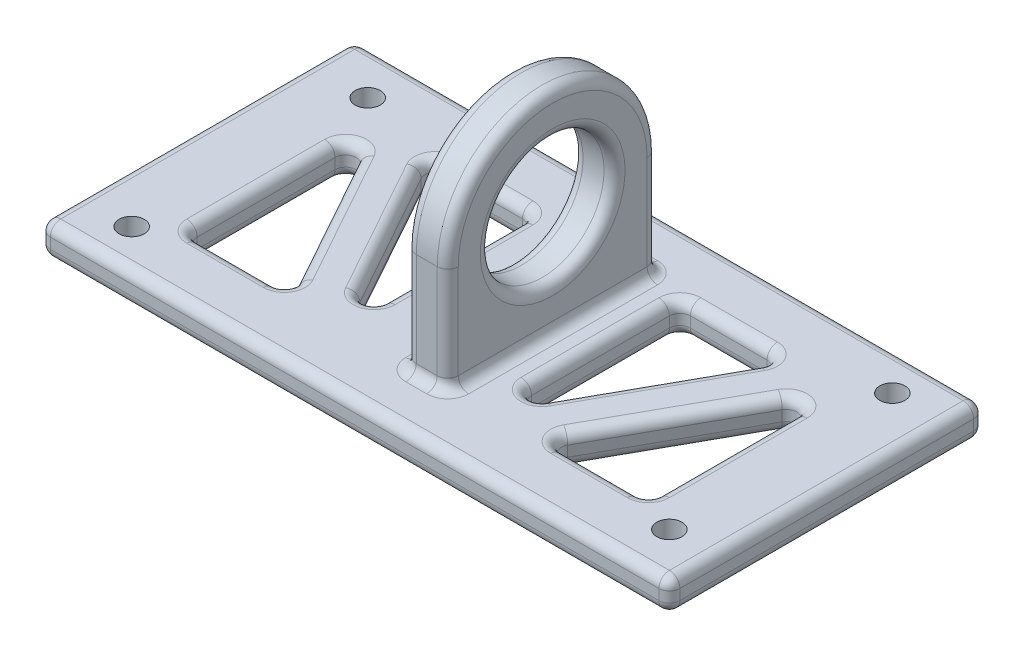
from build123d import *

# Parameters (mm, degrees)
SKETCH1_W               = 76.2
SKETCH1_H               = 38.1
BOSS_EXTRUDE1_DEPTH     = 3.81
SKETCH2_R               = 1.524
CUT_EXTRUDE1_DEPTH      = 43.767143931
SKETCH4_W               = 25.4
SKETCH4_H               = 12.7
BOSS_EXTRUDE2_DEPTH     = 2.54
BOSS_EXTRUDE3_DEPTH     = 5.08
CUT_EXTRUDE2_DEPTH      = 56.959543883
CUT_EXTRUDE2_DEPTH_BACK = 56.959543883
SKETCH6_R               = 7.493
FILLET1_R               = 1.27
CUT_EXTRUDE4_DEPTH      = 50.595085493
CUT_EXTRUDE4_DEPTH_BACK = 50.595085493
FILLET2_R               = 1.27


with BuildPart() as part:
    # Sketch1 → Boss-Extrude1 (new body)
    with BuildSketch(Plane(origin=(0, 0, 0), x_dir=(1, 0, 0), z_dir=(0, 1, 0))):
        Rectangle(SKETCH1_W, SKETCH1_H)
    extrude(amount=BOSS_EXTRUDE1_DEPTH)

    # Sketch2 → Cut-Extrude1 (cut, through all)
    with BuildSketch(Plane(origin=(0, 3.81, 0), x_dir=(1, 0, 0), z_dir=(0, 1, 0))):
        with Locations(Location((31.75, 14.2875, 0), (0, 0, 270))):
            Circle(SKETCH2_R)
        with Locations(Location((32.54375, -13.49375, 0), (0, 0, 270))):
            Circle(SKETCH2_R)
        with Locations(Location((-31.75, -14.2875, 0), (0, 0, 270))):
            Circle(SKETCH2_R)
        with Locations(Location((-30.95625, 13.49375, 0), (0, 0, 270))):
            Circle(SKETCH2_R)
    extrude(amount=-CUT_EXTRUDE1_DEPTH, mode=Mode.SUBTRACT)

    # Sketch4 → Boss-Extrude2 (add, symmetric)
    with BuildSketch(Plane(origin=(2.38125, 0, 0), x_dir=(0, 0, -1), z_dir=(1, 0, 0))):
        with Locations((0, 10.16)):
            Rectangle(SKETCH4_W, SKETCH4_H)
    extrude(amount=BOSS_EXTRUDE2_DEPTH, both=True)

    # Sketch5 → Boss-Extrude3 (add)
    with BuildSketch(Plane(origin=(4.92125, 16.51, -12.7), x_dir=(0, 0, 1), z_dir=(-1, 0, 0))):
        with BuildLine():
            Line((0, 0), (25.4, 0))
            ThreePointArc((25.4, 0), (12.7, 12.7), (0, 0))
        make_face()
    extrude(amount=BOSS_EXTRUDE3_DEPTH)

    # Sketch6 → Cut-Extrude2 (cut, two sides: drawn at the far end of the back side and taken through both)
    with BuildSketch(Plane(origin=(4.92125, 16.51, -12.7), x_dir=(0, 0, 1), z_dir=(-1, 0, 0)).offset(-CUT_EXTRUDE2_DEPTH_BACK)):
        with Locations(Location((12.7, 0, 0), (0, 0, 180))):
            Circle(SKETCH6_R)
    extrude(amount=CUT_EXTRUDE2_DEPTH + CUT_EXTRUDE2_DEPTH_BACK, mode=Mode.SUBTRACT)

    # Fillet1
    fillet1_edges = [part.edges().sort_by_distance(p)[0] for p in [
        (38.1, 3.81, 0),
        (0, 3.81, -19.05),
        (-0.15875, 10.16, -12.7),
        (2.38125, 3.81, -12.7),
        (-0.15875, 10.16, 12.7),
        (-0.15875, 3.81, 0),
        (2.38125, 3.81, 12.7),
        (4.92125, 10.16, -12.7),
        (4.92125, 10.16, 12.7),
        (4.92125, 3.81, 0),
        (-38.1, 3.81, 0),
        (-0.15875, 29.21, 0),
        (4.92125, 29.21, 0),
        (0, 0, -19.05),
        (38.1, 0, 0),
        (4.92125, 16.51, 7.493),
        (-0.15875, 16.51, 7.493),
        (0, 0, 19.05),
        (-38.1, 0, 0),
        (0, 3.81, 19.05),
        (-38.1, 1.905, -19.05),
        (38.1, 1.905, -19.05),
        (38.1, 1.905, 19.05),
        (-38.1, 1.905, 19.05),
    ]]
    fillet(fillet1_edges, radius=FILLET1_R)

    # Sketch10 → Cut-Extrude4 (cut, two sides: drawn at the far end of the back side and taken through both)
    with BuildSketch(Plane(origin=(0, 3.81, 0), x_dir=(1, 0, 0), z_dir=(0, 1, 0)).offset(-CUT_EXTRUDE4_DEPTH_BACK)):
        Polygon((-27.94, -11.43), (-27.94, 11.43), (-15.24, -11.43), align=None)
        Polygon((27.94, 11.43), (15.24, -11.43), (27.94, -11.43), align=None)
        Polygon((-21.59, 11.43), (-8.89, -11.43), (-8.89, 11.43), align=None)
        Polygon((8.89, 11.43), (8.89, -11.43), (21.59, 11.43), align=None)
    extrude(amount=CUT_EXTRUDE4_DEPTH + CUT_EXTRUDE4_DEPTH_BACK, mode=Mode.SUBTRACT)

    # Fillet2
    fillet2_edges = [part.edges().sort_by_distance(p)[0] for p in [
        (-21.59, 1.905, -11.43),
        (-15.24, 3.81, -11.43),
        (-15.24, 0, -11.43),
        (-8.89, 1.905, -11.43),
        (-8.89, 3.81, 0),
        (-8.89, 0, 0),
        (-8.89, 1.905, 11.43),
        (-15.24, 3.81, 0),
        (-15.24, 0, 0),
        (8.89, 1.905, -11.43),
        (15.24, 3.81, -11.43),
        (15.24, 0, -11.43),
        (21.59, 1.905, -11.43),
        (15.24, 3.81, 0),
        (15.24, 0, 0),
        (8.89, 1.905, 11.43),
        (8.89, 3.81, 0),
        (8.89, 0, 0),
        (27.94, 1.905, -11.43),
        (27.94, 3.81, 0),
        (27.94, 0, 0),
        (27.94, 1.905, 11.43),
        (21.59, 3.81, 11.43),
        (21.59, 0, 11.43),
        (15.24, 1.905, 11.43),
        (21.59, 3.81, 0),
        (21.59, 0, 0),
        (-15.24, 1.905, 11.43),
        (-21.59, 3.81, 11.43),
        (-21.59, 0, 11.43),
        (-27.94, 1.905, 11.43),
        (-27.94, 3.81, 0),
        (-27.94, 0, 0),
        (-27.94, 1.905, -11.43),
        (-21.59, 3.81, 0),
        (-21.59, 0, 0),
    ]]
    fillet(fillet2_edges, radius=FILLET2_R)


solid = part.part
